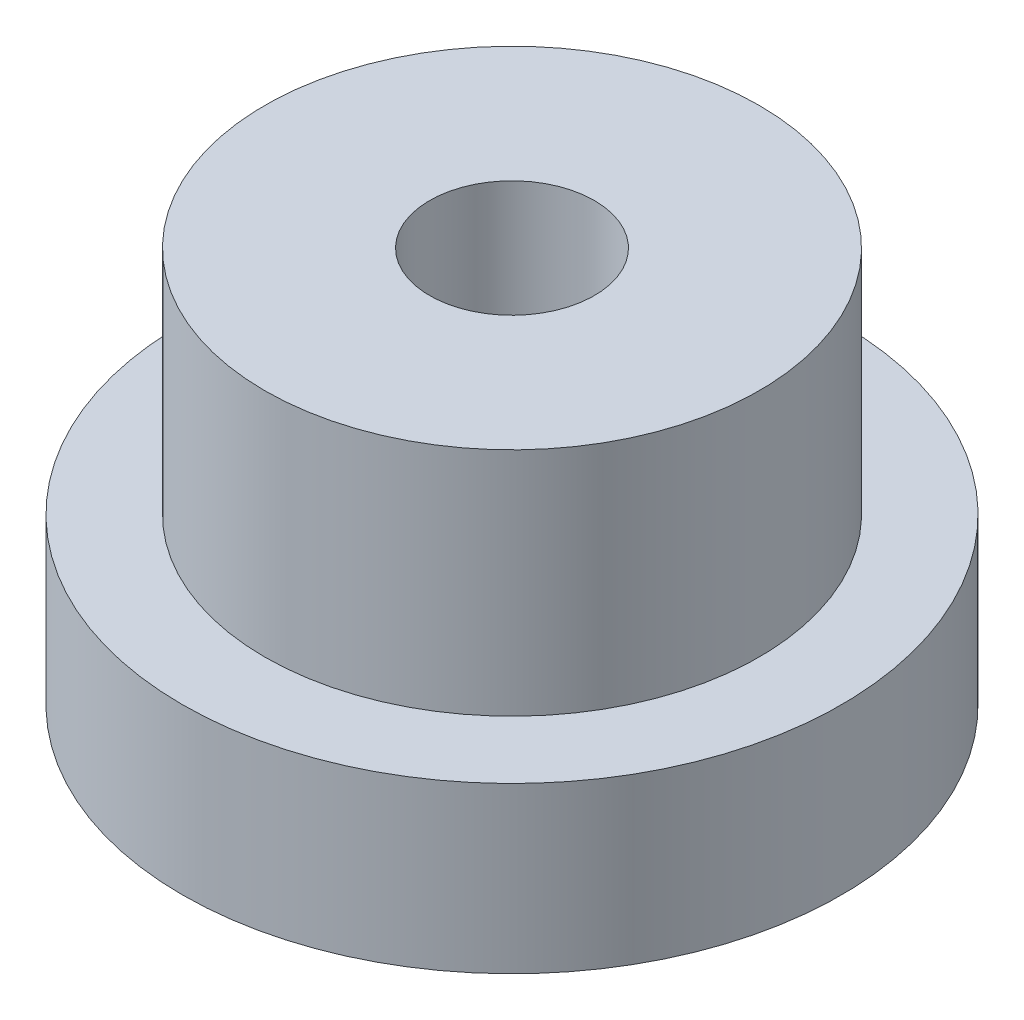
from build123d import *

# Parameters (mm, degrees)
SKETCH_1_R          = 10
EXTRUDE_1_DEPTH     = 5
SKETCH_2_R          = 7.5
EXTRUDE_2_DEPTH     = 7
SKETCH_3_R          = 2.5
CUT_EXTRUDE_1_DEPTH = 12


with BuildPart() as part:
    # 草图1 → 凸台-拉伸1 (new body)
    with BuildSketch(Plane(origin=(0, 0, 0), x_dir=(1, 0, 0), z_dir=(0, 1, 0))):
        with Locations(Location((0, 0, 0), (0, 0, 270))):
            Circle(SKETCH_1_R)
    extrude(amount=EXTRUDE_1_DEPTH)

    # 草图2 → 凸台-拉伸2 (add)
    with BuildSketch(Plane(origin=(0, 5, 0), x_dir=(1, 0, 0), z_dir=(0, 1, 0))):
        with Locations(Location((0, 0, 0), (0, 0, 270))):
            Circle(SKETCH_2_R)
    extrude(amount=EXTRUDE_2_DEPTH)

    # 草图3 → 切除-拉伸1 (cut)
    with BuildSketch(Plane.XZ):
        with Locations(Location((0, 0, 0), (0, 0, 270))):
            Circle(SKETCH_3_R)
    extrude(amount=-CUT_EXTRUDE_1_DEPTH, mode=Mode.SUBTRACT)


solid = part.part
